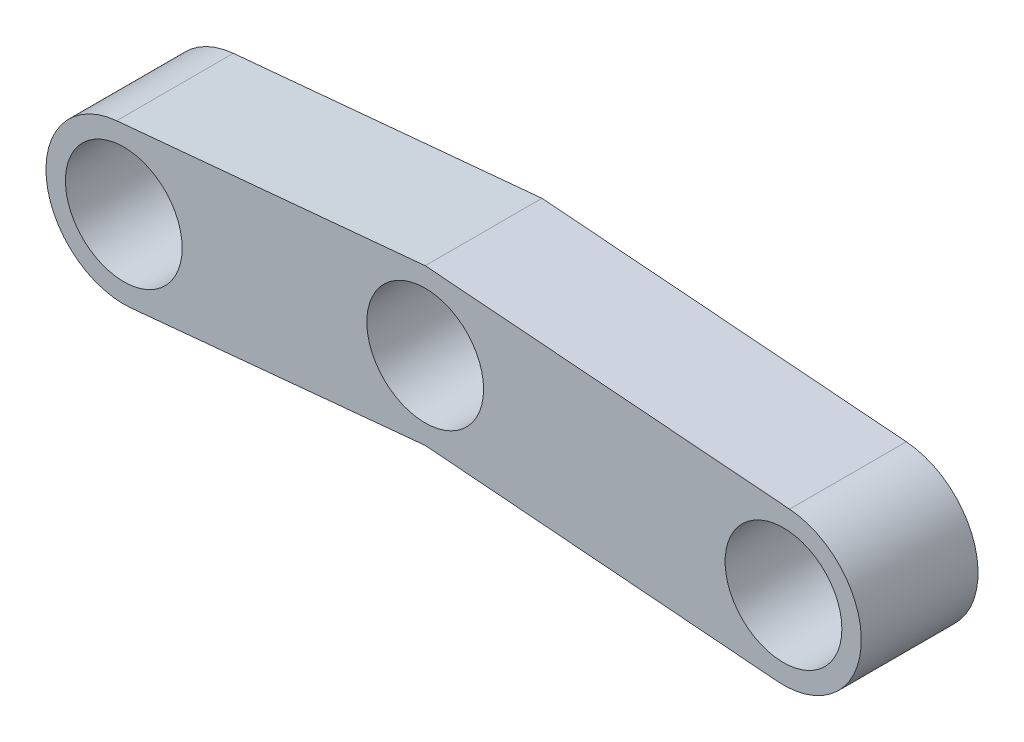
from build123d import *

# Parameters (mm, degrees)
SKETCH1_R           = 15
BOSS_EXTRUDE1_DEPTH = 30


with BuildPart() as part:
    # Sketch1 → Boss-Extrude1 (new body)
    with BuildSketch(Plane.XY):
        with BuildLine():
            Line((-1.85478455, 19.913808633), (77.446717813, 27.3))
            Line((77.446717813, 27.3), (171.085265534, 19.938479729))
            ThreePointArc((171.085265534, 19.938479729), (189.455188028, -1.581002183), (167.923261894, -19.936336862))
            Line((167.923261894, -19.936336862), (77.446717813, -12.7))
            Line((77.446717813, -12.7), (1.900000117, -19.909545438))
            ThreePointArc((1.900000117, -19.909545438), (-19.91168987, -1.877393544), (-1.85478455, 19.913808633))
        make_face()
        with Locations((77.446717813, 7.3)):
            Circle(SKETCH1_R, mode=Mode.SUBTRACT)
        with Locations((169.517775155, 0)):
            Circle(SKETCH1_R, mode=Mode.SUBTRACT)
        Circle(SKETCH1_R, mode=Mode.SUBTRACT)
    extrude(amount=BOSS_EXTRUDE1_DEPTH)


solid = part.part
